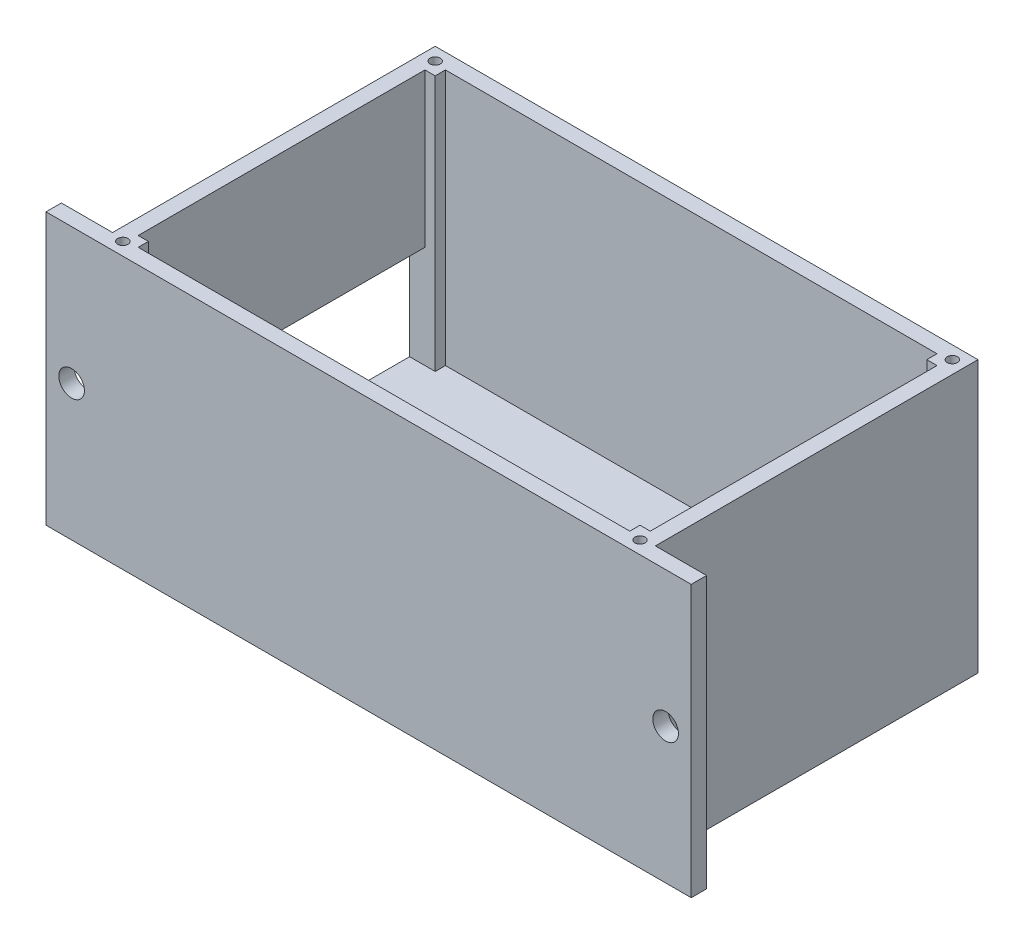
from build123d import *

# Parameters (mm, degrees)
CROQUIS1_W                   = 100
CROQUIS1_H                   = 60
SALIENTE_EXTRUIR1_DEPTH      = 3
SALIENTE_EXTRUIR2_DEPTH      = 50
SALIENTE_EXTRUIR2_DEPTH_BACK = 3
CROQUIS2_W                   = 106
CROQUIS2_H                   = 66
CROQUIS2_W_2                 = 100
CROQUIS2_H_2                 = 60
CROQUIS3_W                   = 2
CROQUIS3_H                   = 2
SALIENTE_EXTRUIR3_DEPTH      = 50
CROQUIS4_W                   = 30
CROQUIS4_H                   = 20
CROQUIS4_W_2                 = 10
CROQUIS4_H_2                 = 10
CORTAR_EXTRUIR2_DEPTH        = 24
CROQUIS5_W                   = 30
CROQUIS5_H                   = 30
CROQUIS5_W_2                 = 26
CROQUIS5_H_2                 = 26
SALIENTE_EXTRUIR4_DEPTH      = 6
CROQUIS6_W                   = 2
CROQUIS6_H                   = 2
CORTAR_EXTRUIR3_DEPTH        = 6
CROQUIS7_W                   = 15
CROQUIS7_H                   = 15
CORTAR_EXTRUIR4_DEPTH        = 6
CROQUIS8_R                   = 1
CORTAR_EXTRUIR5_DEPTH        = 53
CROQUIS9_W                   = 3
CROQUIS9_H                   = 53
SALIENTE_EXTRUIR5_DEPTH      = 10
CROQUIS10_W                  = 3
CROQUIS10_H                  = 53
SALIENTE_EXTRUIR6_DEPTH      = 10
CROQUIS12_R                  = 2.5
CORTAR_EXTRUIR6_DEPTH        = 10


with BuildPart() as part:
    # Croquis1 → Saliente-Extruir1 (new body)
    with BuildSketch(Plane(origin=(0, 0, 0), x_dir=(1, 0, 0), z_dir=(0, 1, 0))):
        with Locations((4.671280277, 8.92733564)):
            Rectangle(CROQUIS1_W, CROQUIS1_H)
    extrude(amount=SALIENTE_EXTRUIR1_DEPTH)

    # Croquis2 → Saliente-Extruir2 (add, two sides: drawn at the far end of the back side and taken through both)
    with BuildSketch(Plane(origin=(0, 3, 0), x_dir=(1, 0, 0), z_dir=(0, 1, 0)).offset(-SALIENTE_EXTRUIR2_DEPTH_BACK)):
        with Locations((4.671280277, 8.92733564)):
            Rectangle(CROQUIS2_W, CROQUIS2_H)
        with Locations((4.671280277, 8.92733564)):
            Rectangle(CROQUIS2_W_2, CROQUIS2_H_2, mode=Mode.SUBTRACT)
    extrude(amount=SALIENTE_EXTRUIR2_DEPTH + SALIENTE_EXTRUIR2_DEPTH_BACK)

    # Croquis3 → Saliente-Extruir3 (add)
    with BuildSketch(Plane(origin=(0, 3, 0), x_dir=(1, 0, 0), z_dir=(0, 1, 0))):
        with Locations((-44.328719723, 37.92733564)):
            Rectangle(CROQUIS3_W, CROQUIS3_H)
        with Locations((-44.328719723, -20.07266436)):
            Rectangle(CROQUIS3_W, CROQUIS3_H)
        with Locations((53.671280277, -20.07266436)):
            Rectangle(CROQUIS3_W, CROQUIS3_H)
        with Locations((53.671280277, 37.92733564)):
            Rectangle(CROQUIS3_W, CROQUIS3_H)
    extrude(amount=SALIENTE_EXTRUIR3_DEPTH)

    # Croquis4 → Cortar-Extruir2 (cut)
    with BuildSketch(Plane.ZY.offset(48.328719723)):
        with Locations((-21.92733564, 13)):
            Rectangle(CROQUIS4_W, CROQUIS4_H)
        with Locations((14.07266436, 8)):
            Rectangle(CROQUIS4_W_2, CROQUIS4_H_2)
    extrude(amount=-CORTAR_EXTRUIR2_DEPTH, mode=Mode.SUBTRACT)

    # Croquis5 → Saliente-Extruir4 (add)
    with BuildSketch(Plane(origin=(0, 0, -41.92733564), x_dir=(-1, 0, 0), z_dir=(0, 0, -1))):
        with Locations((15.328719723, 18)):
            Rectangle(CROQUIS5_W, CROQUIS5_H)
        with Locations((15.328719723, 18)):
            Rectangle(CROQUIS5_W_2, CROQUIS5_H_2, mode=Mode.SUBTRACT)
    extrude(amount=SALIENTE_EXTRUIR4_DEPTH)

    # Croquis6 → Cortar-Extruir3 (cut)
    with BuildSketch(Plane(origin=(0, 0, -47.92733564), x_dir=(-1, 0, 0), z_dir=(0, 0, -1))):
        with Locations((29.328719723, 18)):
            Rectangle(CROQUIS6_W, CROQUIS6_H)
    extrude(amount=-CORTAR_EXTRUIR3_DEPTH, mode=Mode.SUBTRACT)

    # Croquis7 → Cortar-Extruir4 (cut)
    with BuildSketch(Plane(origin=(0, 0, -41.92733564), x_dir=(-1, 0, 0), z_dir=(0, 0, -1))):
        with Locations((-45.171280277, 10.5)):
            Rectangle(CROQUIS7_W, CROQUIS7_H)
    extrude(amount=-CORTAR_EXTRUIR4_DEPTH, mode=Mode.SUBTRACT)

    # Croquis8 → Cortar-Extruir5 (cut)
    with BuildSketch(Plane(origin=(0, 53, 0), x_dir=(1, 0, 0), z_dir=(0, 1, 0))):
        with Locations(Location((-45.828719723, 39.42733564, 0), (0, 0, 270))):
            Circle(CROQUIS8_R)
        with Locations(Location((55.171280277, 39.42733564, 0), (0, 0, 270))):
            Circle(CROQUIS8_R)
        with Locations(Location((55.171280277, -21.57266436, 0), (0, 0, 270))):
            Circle(CROQUIS8_R)
        with Locations(Location((-45.828719723, -21.57266436, 0), (0, 0, 270))):
            Circle(CROQUIS8_R)
    extrude(amount=-CORTAR_EXTRUIR5_DEPTH, mode=Mode.SUBTRACT)

    # Croquis9 → Saliente-Extruir5 (add)
    with BuildSketch(Plane(origin=(57.671280277, 0, 0), x_dir=(0, 0, -1), z_dir=(1, 0, 0))):
        with Locations((-22.57266436, 26.5)):
            Rectangle(CROQUIS9_W, CROQUIS9_H)
    extrude(amount=SALIENTE_EXTRUIR5_DEPTH)

    # Croquis10 → Saliente-Extruir6 (add)
    with BuildSketch(Plane.ZY.offset(48.328719723)):
        with Locations((22.57266436, 26.5)):
            Rectangle(CROQUIS10_W, CROQUIS10_H)
    extrude(amount=SALIENTE_EXTRUIR6_DEPTH)

    # Croquis12 → Cortar-Extruir6 (cut)
    with BuildSketch(Plane(origin=(0, 0, 21.07266436), x_dir=(-1, 0, 0), z_dir=(0, 0, -1))):
        with Locations(Location((-62.671280277, 26.5, 0), (0, 0, 90))):
            Circle(CROQUIS12_R)
        with Locations(Location((53.328719723, 26.5, 0), (0, 0, 90))):
            Circle(CROQUIS12_R)
    extrude(amount=-CORTAR_EXTRUIR6_DEPTH, mode=Mode.SUBTRACT)


solid = part.part
